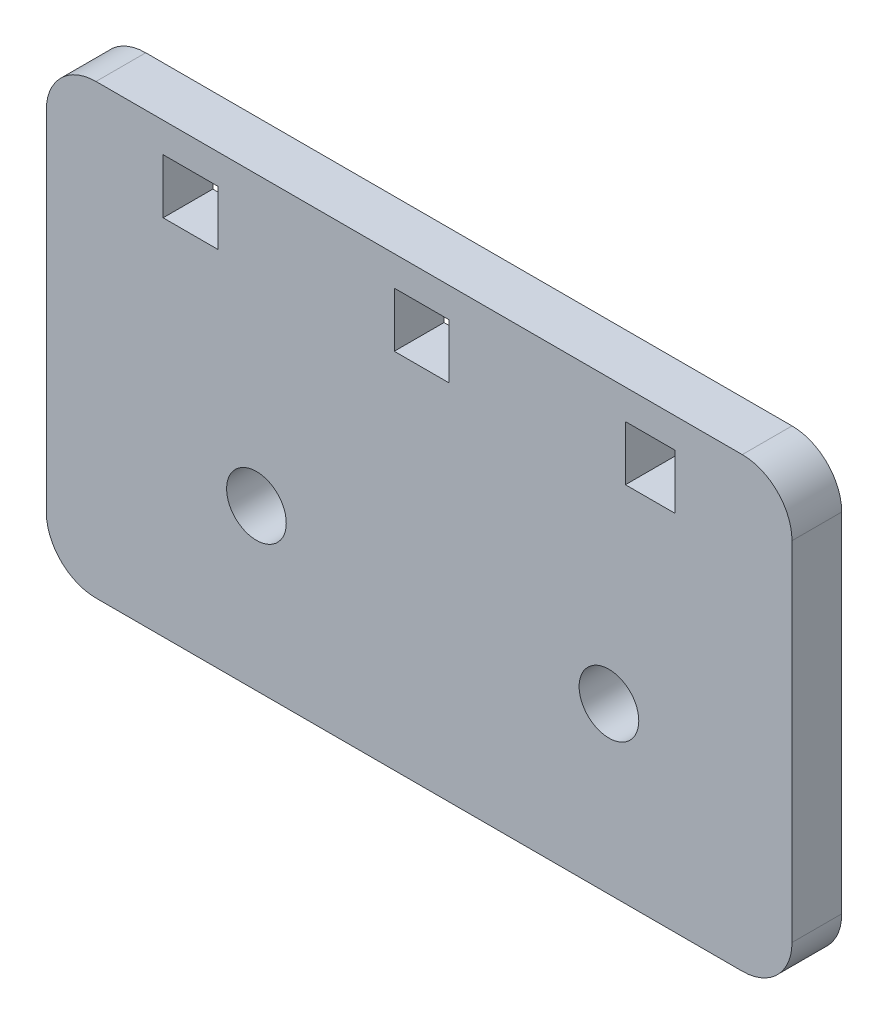
from build123d import *

# Parameters (mm, degrees)
SKETCH_1_W          = 75
SKETCH_1_H          = 45
SKETCH_1_R          = 3
EXTRUDE_1_DEPTH     = 5
SKETCH_2_W          = 5
SKETCH_2_H          = 5.5
SKETCH_2_W_2        = 5.5
CUT_EXTRUDE_1_DEPTH = 5
FILLET_1_R          = 5


with BuildPart() as part:
    # 草图1 → 凸台-拉伸1 (new body)
    with BuildSketch(Plane.XY):
        with Locations((37.5, -22.5)):
            Rectangle(SKETCH_1_W, SKETCH_1_H)
        with Locations((21.13500001, -28.900000005)):
            Circle(SKETCH_1_R, mode=Mode.SUBTRACT)
        with Locations((56.59, -28.4)):
            Circle(SKETCH_1_R, mode=Mode.SUBTRACT)
    extrude(amount=EXTRUDE_1_DEPTH)

    # 草图2 → 切除-拉伸1 (cut)
    with BuildSketch(Plane.XY.offset(5)):
        Polygon((40.5, -8.5), (40.5, -3), (37.5, -3), (35, -3), (35, -8.5), align=None)
        with Locations((60.75, -5.75)):
            Rectangle(SKETCH_2_W, SKETCH_2_H)
        with Locations((14.5, -5.75)):
            Rectangle(SKETCH_2_W_2, SKETCH_2_H)
    extrude(amount=-CUT_EXTRUDE_1_DEPTH, mode=Mode.SUBTRACT)

    # 圆角1
    fillet_1_edges = [part.edges().sort_by_distance(p)[0] for p in [
        (0, 0, 2.5),
        (75, 0, 2.5),
        (75, -45, 2.5),
        (0, -45, 2.5),
    ]]
    fillet(fillet_1_edges, radius=FILLET_1_R)


solid = part.part
